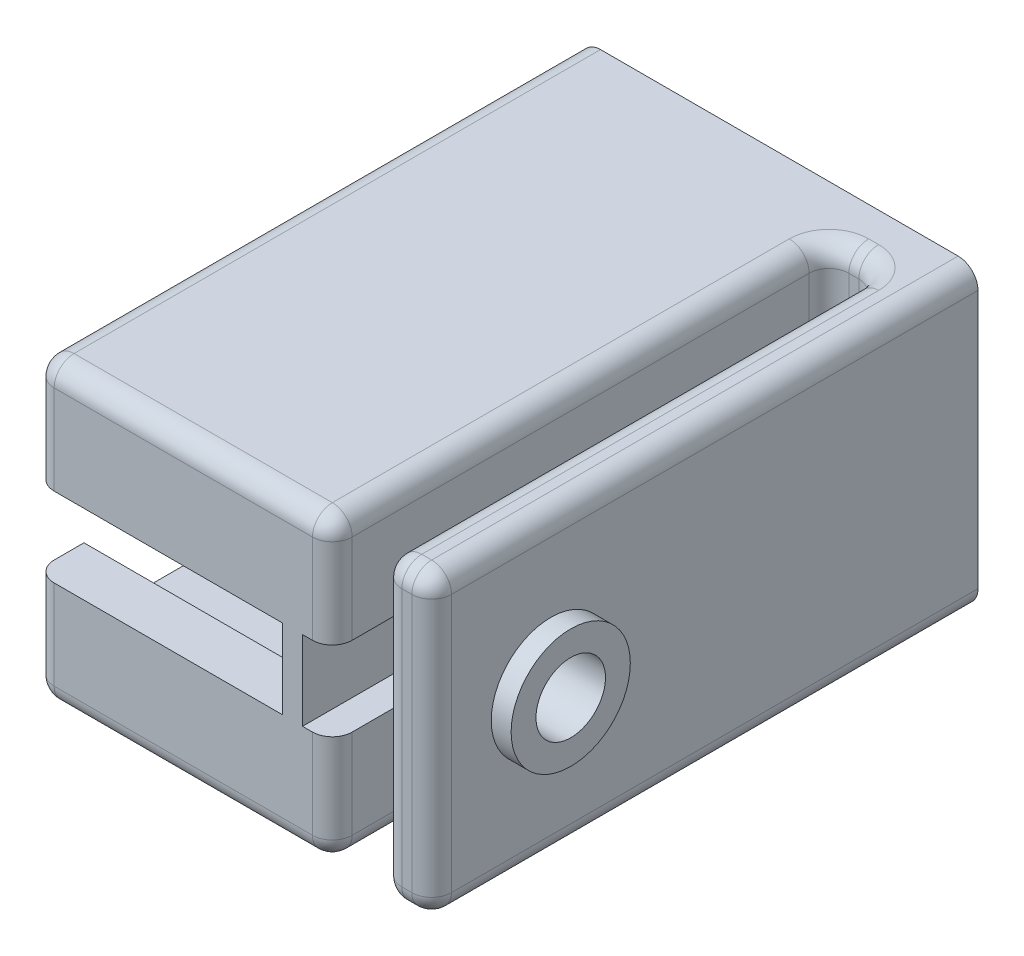
from build123d import *

# Parameters (mm, degrees)
ESQUISSE1_W                                          = 40
ESQUISSE1_H                                          = 30
BOSS_EXTRU_1_DEPTH                                   = 5
ESQUISSE5_W                                          = 50
ESQUISSE5_H                                          = 30
BOSS_EXTRU_3_DEPTH                                   = 30
ENL_V_MAT_EXTRU_1_DEPTH                              = 25
CHAMBRAGE_POUR_T_TE_CYLINDRIQUE_FENDUE_M_D           = 2.7
CHAMBRAGE_POUR_T_TE_CYLINDRIQUE_FENDUE_M_DEPTH       = 7
CHAMBRAGE_POUR_T_TE_CYLINDRIQUE_FENDUE_M_CBORE_D     = 5.5
CHAMBRAGE_POUR_T_TE_CYLINDRIQUE_FENDUE_M_CBORE_DEPTH = 1.8
CHAMBRAGE_POUR_T_TE_CYLINDRIQUE_FENDUE_M_TIP         = 0.811161836
ESQUISSE14_W                                         = 3
ESQUISSE14_H                                         = 8
ENL_V_MAT_EXTRU_2_DEPTH                              = 61.415229868
D_GAGEMENT_M31_D                                     = 3.2
D_GAGEMENT_M31_DEPTH                                 = 7
D_GAGEMENT_M31_TIP                                   = 0.96137699
ESQUISSE16_W                                         = 50
ESQUISSE16_H                                         = 30
ESQUISSE16_R                                         = 3.5
BOSS_EXTRU_4_DEPTH                                   = 5
CONG_1_R                                             = 2
ESQUISSE17_W                                         = 10
ESQUISSE17_H                                         = 10
ENL_V_MAT_EXTRU_3_DEPTH                              = 2
BOSS_EXTRU_5_START                                   = 2
ESQUISSE18_R                                         = 6
ESQUISSE18_R_2                                       = 3.5
BOSS_EXTRU_5_DEPTH                                   = 2


with BuildPart() as part:
    # Esquisse1 → Boss.-Extru.1 (new body)
    with BuildSketch(Plane.XY):
        Rectangle(ESQUISSE1_W, ESQUISSE1_H)
    extrude(amount=BOSS_EXTRU_1_DEPTH)

    # Esquisse5 → Boss.-Extru.3 (add)
    with BuildSketch(Plane.ZY.offset(20)):
        with Locations((30, 0)):
            Rectangle(ESQUISSE5_W, ESQUISSE5_H)
    extrude(amount=-BOSS_EXTRU_3_DEPTH)

    # Esquisse6 → Enlèv. mat.-Extru.1 (cut)
    with BuildSketch(Plane.ZY.offset(20)):
        Polygon((50, 11), (50, 4), (55, 4), (55, -4), (50, -4), (50, -11), (5, -11), (5, 11), align=None)
    extrude(amount=-ENL_V_MAT_EXTRU_1_DEPTH, mode=Mode.SUBTRACT)

    # Chambrage pour tête cylindrique fendue M2.51
    with Locations(Plane.XY.offset(5)):
        with Locations((0, 0)):
            CounterBoreHole(CHAMBRAGE_POUR_T_TE_CYLINDRIQUE_FENDUE_M_D / 2, CHAMBRAGE_POUR_T_TE_CYLINDRIQUE_FENDUE_M_CBORE_D / 2, CHAMBRAGE_POUR_T_TE_CYLINDRIQUE_FENDUE_M_CBORE_DEPTH, depth=CHAMBRAGE_POUR_T_TE_CYLINDRIQUE_FENDUE_M_DEPTH)
            with Locations((0, 0, -(CHAMBRAGE_POUR_T_TE_CYLINDRIQUE_FENDUE_M_DEPTH + CHAMBRAGE_POUR_T_TE_CYLINDRIQUE_FENDUE_M_TIP / 2))):  # 118° drill point
                Cone(0, CHAMBRAGE_POUR_T_TE_CYLINDRIQUE_FENDUE_M_D / 2, CHAMBRAGE_POUR_T_TE_CYLINDRIQUE_FENDUE_M_TIP, mode=Mode.SUBTRACT)

    # Esquisse14 → Enlèv. mat.-Extru.2 (cut, through all)
    with BuildSketch(Plane.XY.offset(55)):
        with Locations((8.5, 0)):
            Rectangle(ESQUISSE14_W, ESQUISSE14_H)
    extrude(amount=-ENL_V_MAT_EXTRU_2_DEPTH, mode=Mode.SUBTRACT)

    # Dégagement M31
    with Locations(Plane.ZY.offset(20)):
        with Locations((2.5, -4), (2.5, 4)):
            Hole(D_GAGEMENT_M31_D / 2, depth=D_GAGEMENT_M31_DEPTH)
            with Locations((0, 0, -(D_GAGEMENT_M31_DEPTH + D_GAGEMENT_M31_TIP / 2))):  # 118° drill point
                Cone(0, D_GAGEMENT_M31_D / 2, D_GAGEMENT_M31_TIP, mode=Mode.SUBTRACT)

    # Esquisse16 → Boss.-Extru.4 (add)
    with BuildSketch(Plane(origin=(20, 0, 0), x_dir=(0, 0, -1), z_dir=(1, 0, 0))):
        with Locations((-30, 0)):
            Rectangle(ESQUISSE16_W, ESQUISSE16_H)
        with Locations((-43, 0)):
            Circle(ESQUISSE16_R, mode=Mode.SUBTRACT)
    extrude(amount=-BOSS_EXTRU_4_DEPTH)

    # Congé1
    cong_1_edges = [part.edges().sort_by_distance(p)[0] for p in [
        (12.5, -15, 5),
        (10, 9.5, 5),
        (10, 15, 30),
        (10, -9.5, 55),
        (-5, 15, 55),
        (10, -15, 30),
        (-5, -15, 55),
        (-20, -9.5, 55),
        (-20, 9.5, 55),
        (10, -9.5, 5),
        (10, 9.5, 55),
        (20, -15, 27.5),
        (-20, -15, 27.5),
        (-20, 15, 27.5),
        (20, 15, 27.5),
        (12.5, 15, 5),
        (15, -15, 30),
        (15, 0, 55),
        (17.5, -15, 55),
        (15, 15, 30),
        (17.5, 15, 55),
        (15, 0, 5),
        (20, 0, 55),
    ]]
    fillet(cong_1_edges, radius=CONG_1_R)

    # Esquisse17 → Enlèv. mat.-Extru.3 (cut)
    with BuildSketch(Plane.ZY.offset(-15)):
        with Locations((43, 0)):
            Rectangle(ESQUISSE17_W, ESQUISSE17_H)
    extrude(amount=-ENL_V_MAT_EXTRU_3_DEPTH, mode=Mode.SUBTRACT)

    # Esquisse18 → Boss.-Extru.5 (add)
    with BuildSketch(Plane(origin=(20, 0, 0), x_dir=(0, 0, -1), z_dir=(1, 0, 0)).offset(BOSS_EXTRU_5_START)):
        with Locations(Location((-43, 0, 0), (0, 0, 180))):
            Circle(ESQUISSE18_R)
        with Locations((-43, 0)):
            Circle(ESQUISSE18_R_2, mode=Mode.SUBTRACT)
    extrude(amount=-BOSS_EXTRU_5_DEPTH)


solid = part.part
